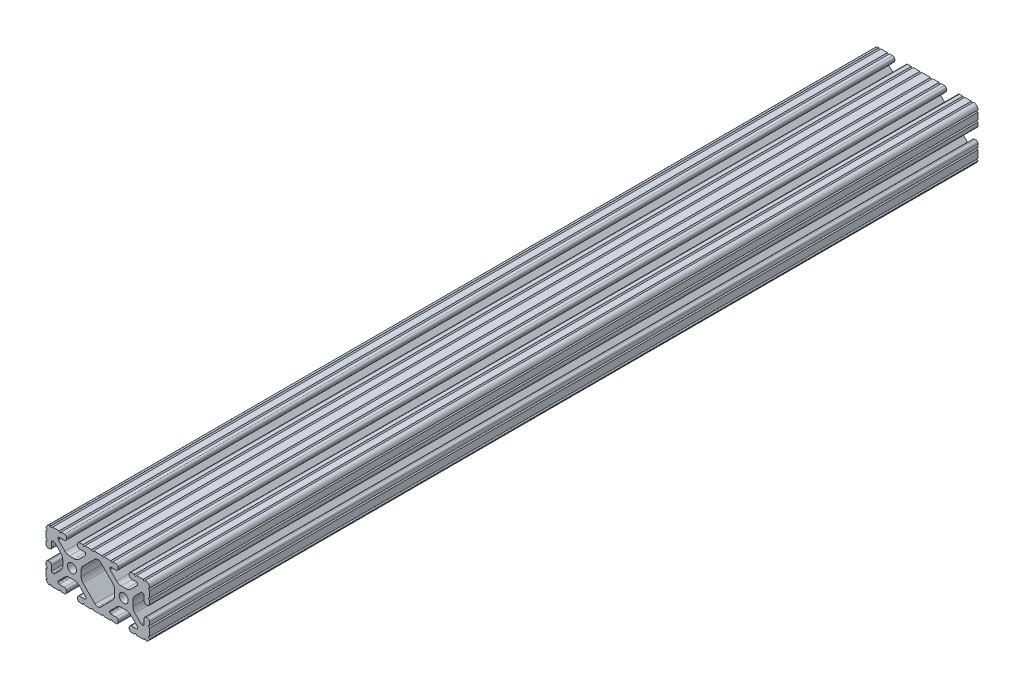
from build123d import *

# Parameters (mm, degrees)
SKETCH1_R      = 3.3274
EXTRUDE1_DEPTH = 609.6


with BuildPart() as part:
    # Sketch1 → Extrude1 (new body)
    with BuildSketch(Plane.XY):
        with BuildLine():
            Line((-3.121121376, -19.05), (3.121121376, -19.05))
            ThreePointArc((3.121121376, -19.05), (3.883121376, -18.288), (4.645121376, -19.05))
            Line((4.645121376, -19.05), (8.633115796, -19.05))
            Line((8.633115796, -19.05), (9.473536067, -19.05))
            ThreePointArc((9.473536067, -19.05), (10.235536067, -18.288), (10.997536067, -19.05))
            Line((10.997536067, -19.05), (13.4112, -19.05))
            ThreePointArc((13.4112, -19.05), (14.524751759, -18.588751759), (14.986, -17.4752))
            Line((14.986, -17.4752), (14.986, -16.5608))
            ThreePointArc((14.986, -16.5608), (14.524751759, -15.447248241), (13.4112, -14.986))
            Line((13.4112, -14.986), (9.652, -14.986))
            ThreePointArc((9.652, -14.986), (9.023382072, -14.725617928), (8.763, -14.097))
            Line((8.763, -14.097), (8.763, -13.687179678))
            ThreePointArc((8.763, -13.687179678), (8.830670671, -13.346975131), (9.023380503, -13.058563318))
            Line((9.023380503, -13.058563318), (13.852498595, -8.229421131))
            ThreePointArc((13.852498595, -8.229421131), (15.393447522, -7.199787805), (17.211122763, -6.838228541))
            Line((17.211122763, -6.838228541), (20.888877237, -6.838228541))
            ThreePointArc((20.888877237, -6.838228541), (22.706552478, -7.199787805), (24.247501405, -8.229421131))
            Line((24.247501405, -8.229421131), (29.076619497, -13.058563318))
            ThreePointArc((29.076619497, -13.058563318), (29.269329329, -13.346975131), (29.337, -13.687179678))
            Line((29.337, -13.687179678), (29.337, -14.097))
            ThreePointArc((29.337, -14.097), (29.076617928, -14.725617928), (28.448, -14.986))
            Line((28.448, -14.986), (24.6888, -14.986))
            ThreePointArc((24.6888, -14.986), (23.575248241, -15.447248241), (23.114, -16.5608))
            Line((23.114, -16.5608), (23.114, -17.4752))
            ThreePointArc((23.114, -17.4752), (23.575248241, -18.588751759), (24.6888, -19.05))
            Line((24.6888, -19.05), (26.945817469, -19.05))
            ThreePointArc((26.945817469, -19.05), (27.707817469, -18.288), (28.469817469, -19.05))
            Line((28.469817469, -19.05), (29.207115796, -19.05))
            Line((29.207115796, -19.05), (34.047273398, -19.05))
            ThreePointArc((34.047273398, -19.05), (34.809273398, -18.288), (35.571273398, -19.05))
            ThreePointArc((35.571273398, -19.05), (37.207577603, -18.182738167), (38.1, -16.560019212))
            ThreePointArc((38.1, -16.560019212), (37.338, -15.798019212), (38.1, -15.036019212))
            Line((38.1, -15.036019212), (38.1, -10.287))
            Line((38.1, -10.287), (38.1, -9.549701672))
            ThreePointArc((38.1, -9.549701672), (37.338, -8.787701672), (38.1, -8.025701672))
            Line((38.1, -8.025701672), (38.1, -5.6388))
            ThreePointArc((38.1, -5.6388), (37.638751759, -4.525248241), (36.5252, -4.064))
            Line((36.5252, -4.064), (35.6108, -4.064))
            ThreePointArc((35.6108, -4.064), (34.497248241, -4.525248241), (34.036, -5.6388))
            Line((34.036, -5.6388), (34.036, -9.398))
            ThreePointArc((34.036, -9.398), (33.775617928, -10.026617928), (33.147, -10.287))
            Line((33.147, -10.287), (32.420656743, -10.287))
            ThreePointArc((32.420656743, -10.287), (32.080450147, -10.21932848), (31.792037247, -10.02661636))
            Line((31.792037247, -10.02661636), (27.197575832, -5.43213202))
            ThreePointArc((27.197575832, -5.43213202), (26.167954729, -3.891188903), (25.8064, -2.07352461))
            Line((25.8064, -2.07352461), (25.8064, 2.07352461))
            ThreePointArc((25.8064, 2.07352461), (26.167954729, 3.891188903), (27.197575832, 5.43213202))
            Line((27.197575832, 5.43213202), (31.792037247, 10.02661636))
            ThreePointArc((31.792037247, 10.02661636), (32.080450147, 10.21932848), (32.420656743, 10.287))
            Line((32.420656743, 10.287), (33.147, 10.287))
            ThreePointArc((33.147, 10.287), (33.775617928, 10.026617928), (34.036, 9.398))
            Line((34.036, 9.398), (34.036, 5.6388))
            ThreePointArc((34.036, 5.6388), (34.497248241, 4.525248241), (35.6108, 4.064))
            Line((35.6108, 4.064), (36.5252, 4.064))
            ThreePointArc((36.5252, 4.064), (37.638751759, 4.525248241), (38.1, 5.6388))
            Line((38.1, 5.6388), (38.1, 8.025701672))
            ThreePointArc((38.1, 8.025701672), (37.338, 8.787701672), (38.1, 9.549701672))
            Line((38.1, 9.549701672), (38.1, 10.287))
            Line((38.1, 10.287), (38.1, 14.375206214))
            ThreePointArc((38.1, 14.375206214), (37.338232276, 15.156019383), (38.137614868, 15.89827725))
            ThreePointArc((38.137614868, 15.89827725), (37.148019028, 18.192014021), (34.819536496, 19.096833012))
            ThreePointArc((34.819536496, 19.096833012), (34.081312886, 18.311776389), (33.296256263, 19.05))
            Line((33.296256263, 19.05), (29.207115796, 19.05))
            Line((29.207115796, 19.05), (28.469817468, 19.05))
            ThreePointArc((28.469817468, 19.05), (27.707817468, 18.288), (26.945817468, 19.05))
            Line((26.945817468, 19.05), (24.558915796, 19.05))
            ThreePointArc((24.558915796, 19.05), (23.53023695, 18.547208069), (23.114, 17.480565346))
            Line((23.114, 17.480565346), (23.114, 16.5608))
            ThreePointArc((23.114, 16.5608), (23.575248241, 15.447248241), (24.6888, 14.986))
            Line((24.6888, 14.986), (28.295243665, 14.986))
            ThreePointArc((28.295243665, 14.986), (28.923861593, 14.725617928), (29.184243665, 14.097))
            Line((29.184243665, 14.097), (29.184243665, 13.53442258))
            ThreePointArc((29.184243665, 13.53442258), (29.116572993, 13.194218033), (28.923863161, 12.90580622))
            Line((28.923863161, 12.90580622), (24.247501405, 8.229421131))
            ThreePointArc((24.247501405, 8.229421131), (22.706552478, 7.199787805), (20.888877237, 6.838228541))
            Line((20.888877237, 6.838228541), (17.211122763, 6.838228541))
            ThreePointArc((17.211122763, 6.838228541), (15.393447522, 7.199787805), (13.852498595, 8.229421131))
            Line((13.852498595, 8.229421131), (9.176136839, 12.90580622))
            ThreePointArc((9.176136839, 12.90580622), (8.983427007, 13.194218033), (8.915756335, 13.53442258))
            Line((8.915756335, 13.53442258), (8.915756335, 14.097))
            ThreePointArc((8.915756335, 14.097), (9.176138407, 14.725617928), (9.804756335, 14.986))
            Line((9.804756335, 14.986), (13.4112, 14.986))
            ThreePointArc((13.4112, 14.986), (14.524751759, 15.447248241), (14.986, 16.5608))
            Line((14.986, 16.5608), (14.986, 17.496772581))
            ThreePointArc((14.986, 17.496772581), (14.531070222, 18.595070222), (13.432772581, 19.05))
            Line((13.432772581, 19.05), (10.997536067, 19.05))
            ThreePointArc((10.997536067, 19.05), (10.235536067, 18.288), (9.473536067, 19.05))
            Line((9.473536067, 19.05), (8.633115796, 19.05))
            Line((8.633115796, 19.05), (4.645121376, 19.05))
            ThreePointArc((4.645121376, 19.05), (3.883121376, 18.288), (3.121121376, 19.05))
            Line((3.121121376, 19.05), (-3.121121376, 19.05))
            ThreePointArc((-3.121121376, 19.05), (-3.883121376, 18.288), (-4.645121376, 19.05))
            Line((-4.645121376, 19.05), (-8.633115796, 19.05))
            Line((-8.633115796, 19.05), (-9.473536067, 19.05))
            ThreePointArc((-9.473536067, 19.05), (-10.235536067, 18.288), (-10.997536067, 19.05))
            Line((-10.997536067, 19.05), (-13.432772581, 19.05))
            ThreePointArc((-13.432772581, 19.05), (-14.531070222, 18.595070222), (-14.986, 17.496772581))
            Line((-14.986, 17.496772581), (-14.986, 16.5608))
            ThreePointArc((-14.986, 16.5608), (-14.524751759, 15.447248241), (-13.4112, 14.986))
            Line((-13.4112, 14.986), (-9.804756335, 14.986))
            ThreePointArc((-9.804756335, 14.986), (-9.176138407, 14.725617928), (-8.915756335, 14.097))
            Line((-8.915756335, 14.097), (-8.915756335, 13.53442258))
            ThreePointArc((-8.915756335, 13.53442258), (-8.983427007, 13.194218033), (-9.176136839, 12.90580622))
            Line((-9.176136839, 12.90580622), (-13.852498595, 8.229421131))
            ThreePointArc((-13.852498595, 8.229421131), (-15.393447522, 7.199787805), (-17.211122763, 6.838228541))
            Line((-17.211122763, 6.838228541), (-20.888877237, 6.838228541))
            ThreePointArc((-20.888877237, 6.838228541), (-22.706552478, 7.199787805), (-24.247501405, 8.229421131))
            Line((-24.247501405, 8.229421131), (-28.923863161, 12.90580622))
            ThreePointArc((-28.923863161, 12.90580622), (-29.116572993, 13.194218033), (-29.184243665, 13.53442258))
            Line((-29.184243665, 13.53442258), (-29.184243665, 14.097))
            ThreePointArc((-29.184243665, 14.097), (-28.923861593, 14.725617928), (-28.295243665, 14.986))
            Line((-28.295243665, 14.986), (-24.6888, 14.986))
            ThreePointArc((-24.6888, 14.986), (-23.575248241, 15.447248241), (-23.114, 16.5608))
            Line((-23.114, 16.5608), (-23.114, 17.480565346))
            ThreePointArc((-23.114, 17.480565346), (-23.53023695, 18.547208069), (-24.558915796, 19.05))
            Line((-24.558915796, 19.05), (-26.945817468, 19.05))
            ThreePointArc((-26.945817468, 19.05), (-27.707817468, 18.288), (-28.469817468, 19.05))
            Line((-28.469817468, 19.05), (-29.207115796, 19.05))
            Line((-29.207115796, 19.05), (-33.296256263, 19.05))
            ThreePointArc((-33.296256263, 19.05), (-34.081312886, 18.311776389), (-34.819536496, 19.096833012))
            ThreePointArc((-34.819536496, 19.096833012), (-37.148019028, 18.192014021), (-38.137614868, 15.89827725))
            ThreePointArc((-38.137614868, 15.89827725), (-37.338232276, 15.156019383), (-38.1, 14.375206214))
            Line((-38.1, 14.375206214), (-38.1, 10.287))
            Line((-38.1, 10.287), (-38.1, 9.549701672))
            ThreePointArc((-38.1, 9.549701672), (-37.338, 8.787701672), (-38.1, 8.025701672))
            Line((-38.1, 8.025701672), (-38.1, 5.6388))
            ThreePointArc((-38.1, 5.6388), (-37.638751759, 4.525248241), (-36.5252, 4.064))
            Line((-36.5252, 4.064), (-35.6108, 4.064))
            ThreePointArc((-35.6108, 4.064), (-34.497248241, 4.525248241), (-34.036, 5.6388))
            Line((-34.036, 5.6388), (-34.036, 9.398))
            ThreePointArc((-34.036, 9.398), (-33.775617928, 10.026617928), (-33.147, 10.287))
            Line((-33.147, 10.287), (-32.420656743, 10.287))
            ThreePointArc((-32.420656743, 10.287), (-32.080450147, 10.21932848), (-31.792037247, 10.02661636))
            Line((-31.792037247, 10.02661636), (-27.197575832, 5.43213202))
            ThreePointArc((-27.197575832, 5.43213202), (-26.167954729, 3.891188903), (-25.8064, 2.07352461))
            Line((-25.8064, 2.07352461), (-25.8064, -2.07352461))
            ThreePointArc((-25.8064, -2.07352461), (-26.167954729, -3.891188903), (-27.197575832, -5.43213202))
            Line((-27.197575832, -5.43213202), (-31.792037247, -10.02661636))
            ThreePointArc((-31.792037247, -10.02661636), (-32.080450147, -10.21932848), (-32.420656743, -10.287))
            Line((-32.420656743, -10.287), (-33.147, -10.287))
            ThreePointArc((-33.147, -10.287), (-33.775617928, -10.026617928), (-34.036, -9.398))
            Line((-34.036, -9.398), (-34.036, -5.6388))
            ThreePointArc((-34.036, -5.6388), (-34.497248241, -4.525248241), (-35.6108, -4.064))
            Line((-35.6108, -4.064), (-36.5252, -4.064))
            ThreePointArc((-36.5252, -4.064), (-37.638751759, -4.525248241), (-38.1, -5.6388))
            Line((-38.1, -5.6388), (-38.1, -8.025701672))
            ThreePointArc((-38.1, -8.025701672), (-37.338, -8.787701672), (-38.1, -9.549701672))
            Line((-38.1, -9.549701672), (-38.1, -10.287))
            Line((-38.1, -10.287), (-38.1, -15.036019212))
            ThreePointArc((-38.1, -15.036019212), (-37.338, -15.798019212), (-38.1, -16.560019212))
            ThreePointArc((-38.1, -16.560019212), (-37.20882252, -18.184002456), (-35.571273398, -19.05))
            ThreePointArc((-35.571273398, -19.05), (-34.809273398, -18.288), (-34.047273398, -19.05))
            Line((-34.047273398, -19.05), (-29.207115796, -19.05))
            Line((-29.207115796, -19.05), (-28.469817469, -19.05))
            ThreePointArc((-28.469817469, -19.05), (-27.707817469, -18.288), (-26.945817469, -19.05))
            Line((-26.945817469, -19.05), (-24.6888, -19.05))
            ThreePointArc((-24.6888, -19.05), (-23.575248241, -18.588751759), (-23.114, -17.4752))
            Line((-23.114, -17.4752), (-23.114, -16.5608))
            ThreePointArc((-23.114, -16.5608), (-23.575248241, -15.447248241), (-24.6888, -14.986))
            Line((-24.6888, -14.986), (-28.448, -14.986))
            ThreePointArc((-28.448, -14.986), (-29.076617928, -14.725617928), (-29.337, -14.097))
            Line((-29.337, -14.097), (-29.337, -13.687179678))
            ThreePointArc((-29.337, -13.687179678), (-29.269329329, -13.346975131), (-29.076619497, -13.058563318))
            Line((-29.076619497, -13.058563318), (-24.247501405, -8.229421131))
            ThreePointArc((-24.247501405, -8.229421131), (-22.706552478, -7.199787805), (-20.888877237, -6.838228541))
            Line((-20.888877237, -6.838228541), (-17.211122763, -6.838228541))
            ThreePointArc((-17.211122763, -6.838228541), (-15.393447522, -7.199787805), (-13.852498595, -8.229421131))
            Line((-13.852498595, -8.229421131), (-9.023380503, -13.058563318))
            ThreePointArc((-9.023380503, -13.058563318), (-8.830670671, -13.346975131), (-8.763, -13.687179678))
            Line((-8.763, -13.687179678), (-8.763, -14.097))
            ThreePointArc((-8.763, -14.097), (-9.023382072, -14.725617928), (-9.652, -14.986))
            Line((-9.652, -14.986), (-13.4112, -14.986))
            ThreePointArc((-13.4112, -14.986), (-14.524751759, -15.447248241), (-14.986, -16.5608))
            Line((-14.986, -16.5608), (-14.986, -17.4752))
            ThreePointArc((-14.986, -17.4752), (-14.524751759, -18.588751759), (-13.4112, -19.05))
            Line((-13.4112, -19.05), (-10.997536067, -19.05))
            ThreePointArc((-10.997536067, -19.05), (-10.235536067, -18.288), (-9.473536067, -19.05))
            Line((-9.473536067, -19.05), (-8.633115796, -19.05))
            Line((-8.633115796, -19.05), (-4.645121376, -19.05))
            ThreePointArc((-4.645121376, -19.05), (-3.883121376, -18.288), (-3.121121376, -19.05))
        make_face()
        with Locations((19.05, 0)):
            Circle(SKETCH1_R, mode=Mode.SUBTRACT)
        with Locations((-19.05, 0)):
            Circle(SKETCH1_R, mode=Mode.SUBTRACT)
        with BuildLine():
            Line((2.077035361, 14.257564863), (10.902424168, 5.43213202))
            ThreePointArc((10.902424168, 5.43213202), (11.932045271, 3.891188903), (12.2936, 2.07352461))
            Line((12.2936, 2.07352461), (12.2936, -2.07352461))
            ThreePointArc((12.2936, -2.07352461), (11.932045271, -3.891188903), (10.902424168, -5.43213202))
            Line((10.902424168, -5.43213202), (2.077035361, -14.257564863))
            ThreePointArc((2.077035361, -14.257564863), (1.124045601, -14.892973012), (0, -15.113096807))
            ThreePointArc((0, -15.113096807), (-1.124045601, -14.892973012), (-2.077035361, -14.257564863))
            Line((-2.077035361, -14.257564863), (-10.902424168, -5.43213202))
            ThreePointArc((-10.902424168, -5.43213202), (-11.932045271, -3.891188903), (-12.2936, -2.07352461))
            Line((-12.2936, -2.07352461), (-12.2936, 2.07352461))
            ThreePointArc((-12.2936, 2.07352461), (-11.932045271, 3.891188903), (-10.902424168, 5.43213202))
            Line((-10.902424168, 5.43213202), (-2.077035361, 14.257564863))
            ThreePointArc((-2.077035361, 14.257564863), (-1.124045601, 14.892973012), (0, 15.113096807))
            ThreePointArc((0, 15.113096807), (1.124045601, 14.892973012), (2.077035361, 14.257564863))
        make_face(mode=Mode.SUBTRACT)
    extrude(amount=-EXTRUDE1_DEPTH)


solid = part.part
